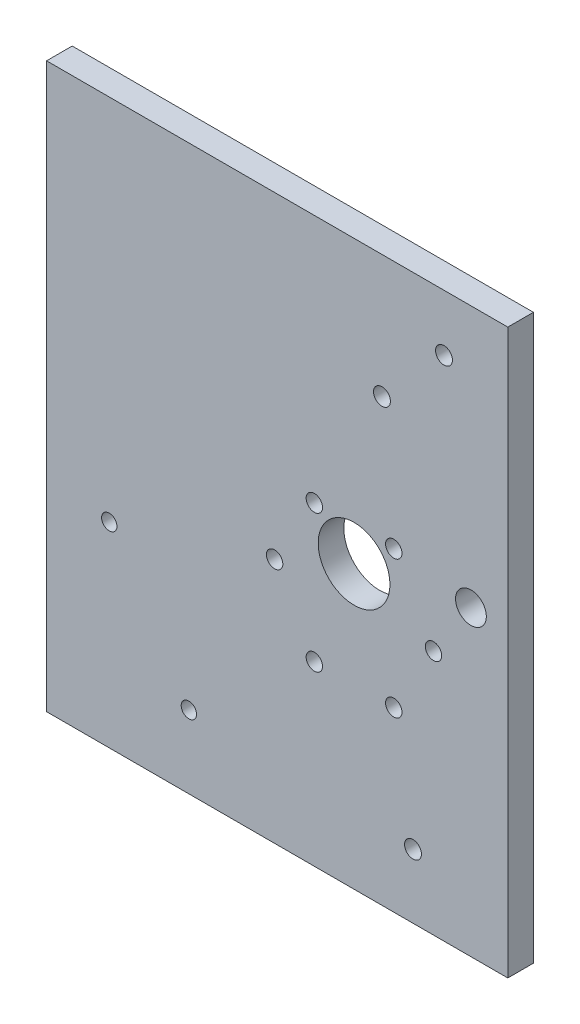
from build123d import *

# Parameters (mm, degrees)
SKETCH_2_R          = 1.6
SKETCH_2_R_2        = 7
EXTRUDE_1_DEPTH     = 5
SKETCH_4_R          = 3.004319303
CUT_EXTRUDE_2_DEPTH = 10
SKETCH_5_R          = 1.65
SKETCH_5_R_2        = 1.5
CUT_EXTRUDE_3_DEPTH = 10


with BuildPart() as part:
    # Эскиз2 → Бобышка-Вытянуть1 (new body)
    with BuildSketch(Plane.XY):
        Polygon((-25, 62), (-60, 62), (-60, -48), (-25, -48), (30, -48), (30, 62), align=None)
        with Locations((-15.5, 0)):
            Circle(SKETCH_2_R, mode=Mode.SUBTRACT)
        with Locations((-7.75, 13.423393759)):
            Circle(SKETCH_2_R, mode=Mode.SUBTRACT)
        with Locations((7.75, 13.423393759)):
            Circle(SKETCH_2_R, mode=Mode.SUBTRACT)
        with Locations((15.5, 0)):
            Circle(SKETCH_2_R, mode=Mode.SUBTRACT)
        with Locations((7.75, -13.423393759)):
            Circle(SKETCH_2_R, mode=Mode.SUBTRACT)
        with Locations((-7.75, -13.423393759)):
            Circle(SKETCH_2_R, mode=Mode.SUBTRACT)
        with Locations((0, 7)):
            Circle(SKETCH_2_R_2, mode=Mode.SUBTRACT)
    extrude(amount=EXTRUDE_1_DEPTH)

    # Эскиз4 → Вырез-Вытянуть2 (cut)
    with BuildSketch(Plane.XY.offset(5)):
        with Locations((22.80785145, 10.989617997)):
            Circle(SKETCH_4_R)
    extrude(amount=-CUT_EXTRUDE_2_DEPTH, mode=Mode.SUBTRACT)

    # Эскиз5 → Вырез-Вытянуть3 (cut)
    with BuildSketch(Plane(origin=(0, 0, 0), x_dir=(-1, 0, 0), z_dir=(0, 0, -1))):
        with Locations((-17.551724138, 51)):
            Circle(SKETCH_5_R)
        with Locations((-5.448275862, 38)):
            Circle(SKETCH_5_R)
        with Locations((32.234685073, -33.82)):
            Circle(SKETCH_5_R_2)
        with Locations((47.765314927, -9.82)):
            Circle(SKETCH_5_R_2)
        with Locations((-11.5, -35.5)):
            Circle(SKETCH_5_R)
    extrude(amount=-CUT_EXTRUDE_3_DEPTH, mode=Mode.SUBTRACT)


solid = part.part
